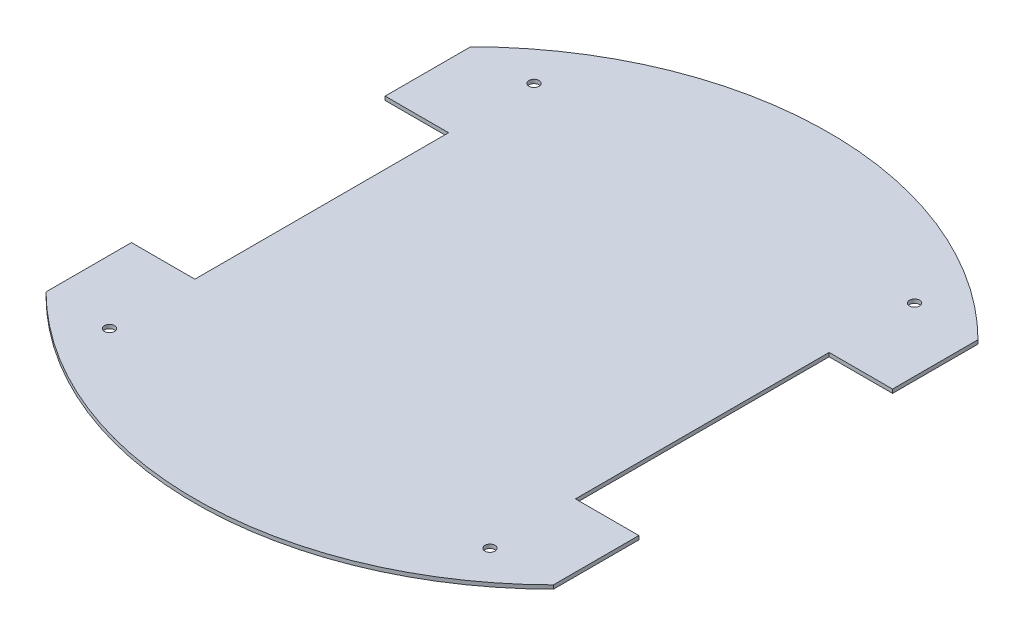
from build123d import *

# Parameters (mm, degrees)
BOSS_EXTRUDE1_DEPTH = 3
SKETCH4_R           = 4
CUT_EXTRUDE1_DEPTH  = 10


with BuildPart() as part:
    # Sketch3 → Boss-Extrude1 (new body)
    with BuildSketch(Plane(origin=(0, 0, 0), x_dir=(1, 0, 0), z_dir=(0, 1, 0))):
        with BuildLine():
            Line((-150, 100), (-200, 100))
            Line((-200, 100), (-200, 167.359909647))
            ThreePointArc((-200, 167.359909647), (0, 250), (200, 167.359909647))
            Line((200, 167.359909647), (200, 100))
            Line((200, 100), (150, 100))
            Line((150, 100), (150, -100))
            Line((150, -100), (200, -100))
            Line((200, -100), (200, -167.359909647))
            ThreePointArc((200, -167.359909647), (0, -250), (-200, -167.359909647))
            Line((-200, -167.359909647), (-200, -100))
            Line((-200, -100), (-150, -100))
            Line((-150, -100), (-150, 100))
        make_face()
    extrude(amount=BOSS_EXTRUDE1_DEPTH)

    # Sketch4 → Cut-Extrude1 (cut)
    with BuildSketch(Plane(origin=(0, 3, 0), x_dir=(1, 0, 0), z_dir=(0, 1, 0))):
        with Locations(Location((-150, 167.359909647, 0), (0, 0, 270))):
            Circle(SKETCH4_R)
        with Locations(Location((150, 167.359909647, 0), (0, 0, 270))):
            Circle(SKETCH4_R)
        with Locations(Location((150, -167.359909647, 0), (0, 0, 270))):
            Circle(SKETCH4_R)
        with Locations(Location((-150, -167.359909647, 0), (0, 0, 270))):
            Circle(SKETCH4_R)
    extrude(amount=-CUT_EXTRUDE1_DEPTH, mode=Mode.SUBTRACT)


solid = part.part
